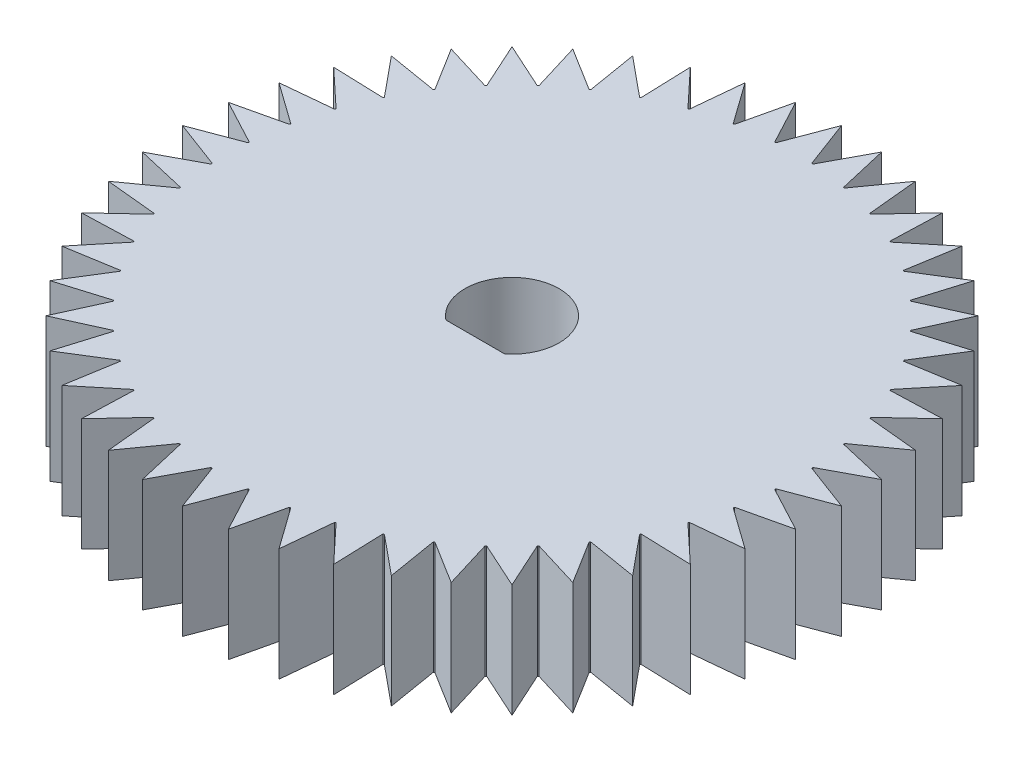
from build123d import *

# Parameters (mm, degrees)
EXTRUDE_5_DEPTH = 6


with BuildPart() as part:
    # Эскиз1 → Бобышка-Вытянуть5 (new body)
    with BuildSketch(Plane(origin=(0, 0, 0), x_dir=(1, 0, 0), z_dir=(0, 1, 0))):
        with BuildLine():
            Line((2.895366476, 14.71790926), (2.284208364, 17.350285074))
            Line((2.284208364, 17.350285074), (1.012565965, 14.965784649))
            ThreePointArc((1.012565965, 14.965784649), (0.981046938, 14.967883849), (0.949523561, 14.969916667))
            Line((0.949523561, 14.969916667), (0, 17.5))
            Line((0, 17.5), (-0.949523561, 14.969916667))
            ThreePointArc((-0.949523561, 14.969916667), (-0.981046938, 14.967883849), (-1.012565965, 14.965784649))
            Line((-1.012565965, 14.965784649), (-2.284208364, 17.350285074))
            Line((-2.284208364, 17.350285074), (-2.895366476, 14.71790926))
            ThreePointArc((-2.895366476, 14.71790926), (-2.92635483, 14.711779206), (-2.957330207, 14.705583907))
            Line((-2.957330207, 14.705583907), (-4.529333289, 16.90370196))
            Line((-4.529333289, 16.90370196), (-4.791668867, 14.214074344))
            ThreePointArc((-4.791668867, 14.214074344), (-4.82159198, 14.203951942), (-4.851493708, 14.193766547))
            Line((-4.851493708, 14.193766547), (-6.696960066, 16.167891819))
            Line((-6.696960066, 16.167891819), (-6.605984476, 13.467032676))
            ThreePointArc((-6.605984476, 13.467032676), (-6.634330353, 13.453091123), (-6.662646808, 13.439089906))
            Line((-6.662646808, 13.439089906), (-8.75, 15.155444566))
            Line((-8.75, 15.155444566), (-8.307269859, 12.489566345))
            ThreePointArc((-8.307269859, 12.489566345), (-8.333553495, 12.472044185), (-8.359800173, 12.454466711))
            Line((-8.359800173, 12.454466711), (-10.653325008, 13.883683455))
            Line((-10.653325008, 13.883683455), (-9.866415551, 11.298400071))
            ThreePointArc((-9.866415551, 11.298400071), (-9.890187227, 11.277597112), (-9.91391504, 11.256744138))
            Line((-9.91391504, 11.256744138), (-12.374368671, 12.374368671))
            Line((-12.374368671, 12.374368671), (-11.256744138, 9.91391504))
            ThreePointArc((-11.256744138, 9.91391504), (-11.277597112, 9.890187227), (-11.298400071, 9.866415551))
            Line((-11.298400071, 9.866415551), (-13.883683455, 10.653325008))
            Line((-13.883683455, 10.653325008), (-12.454466711, 8.359800173))
            ThreePointArc((-12.454466711, 8.359800173), (-12.472044185, 8.333553495), (-12.489566345, 8.307269859))
            Line((-12.489566345, 8.307269859), (-15.155444566, 8.75))
            Line((-15.155444566, 8.75), (-13.439089906, 6.662646808))
            ThreePointArc((-13.439089906, 6.662646808), (-13.453091123, 6.634330353), (-13.467032676, 6.605984476))
            Line((-13.467032676, 6.605984476), (-16.167891819, 6.696960066))
            Line((-16.167891819, 6.696960066), (-14.193766547, 4.851493708))
            ThreePointArc((-14.193766547, 4.851493708), (-14.203951942, 4.82159198), (-14.214074344, 4.791668867))
            Line((-14.214074344, 4.791668867), (-16.90370196, 4.529333289))
            Line((-16.90370196, 4.529333289), (-14.705583907, 2.957330207))
            ThreePointArc((-14.705583907, 2.957330207), (-14.711779206, 2.92635483), (-14.71790926, 2.895366476))
            Line((-14.71790926, 2.895366476), (-17.350285074, 2.284208364))
            Line((-17.350285074, 2.284208364), (-14.965784649, 1.012565965))
            ThreePointArc((-14.965784649, 1.012565965), (-14.967883849, 0.981046938), (-14.969916667, 0.949523561))
            Line((-14.969916667, 0.949523561), (-17.5, 0))
            Line((-17.5, 0), (-14.969916667, -0.949523561))
            ThreePointArc((-14.969916667, -0.949523561), (-14.967883849, -0.981046938), (-14.965784649, -1.012565965))
            Line((-14.965784649, -1.012565965), (-17.350285074, -2.284208364))
            Line((-17.350285074, -2.284208364), (-14.71790926, -2.895366476))
            ThreePointArc((-14.71790926, -2.895366476), (-14.711779206, -2.92635483), (-14.705583907, -2.957330207))
            Line((-14.705583907, -2.957330207), (-16.90370196, -4.529333289))
            Line((-16.90370196, -4.529333289), (-14.214074344, -4.791668867))
            ThreePointArc((-14.214074344, -4.791668867), (-14.203951942, -4.82159198), (-14.193766547, -4.851493708))
            Line((-14.193766547, -4.851493708), (-16.167891819, -6.696960066))
            Line((-16.167891819, -6.696960066), (-13.467032676, -6.605984476))
            ThreePointArc((-13.467032676, -6.605984476), (-13.453091123, -6.634330353), (-13.439089906, -6.662646808))
            Line((-13.439089906, -6.662646808), (-15.155444566, -8.75))
            Line((-15.155444566, -8.75), (-12.489566345, -8.307269859))
            ThreePointArc((-12.489566345, -8.307269859), (-12.472044185, -8.333553495), (-12.454466711, -8.359800173))
            Line((-12.454466711, -8.359800173), (-13.883683455, -10.653325008))
            Line((-13.883683455, -10.653325008), (-11.298400071, -9.866415551))
            ThreePointArc((-11.298400071, -9.866415551), (-11.277597112, -9.890187227), (-11.256744138, -9.91391504))
            Line((-11.256744138, -9.91391504), (-12.374368671, -12.374368671))
            Line((-12.374368671, -12.374368671), (-9.91391504, -11.256744138))
            ThreePointArc((-9.91391504, -11.256744138), (-9.890187227, -11.277597112), (-9.866415551, -11.298400071))
            Line((-9.866415551, -11.298400071), (-10.653325008, -13.883683455))
            Line((-10.653325008, -13.883683455), (-8.359800173, -12.454466711))
            ThreePointArc((-8.359800173, -12.454466711), (-8.333553495, -12.472044185), (-8.307269859, -12.489566345))
            Line((-8.307269859, -12.489566345), (-8.75, -15.155444566))
            Line((-8.75, -15.155444566), (-6.662646808, -13.439089906))
            ThreePointArc((-6.662646808, -13.439089906), (-6.634330353, -13.453091123), (-6.605984476, -13.467032676))
            Line((-6.605984476, -13.467032676), (-6.696960066, -16.167891819))
            Line((-6.696960066, -16.167891819), (-4.851493708, -14.193766547))
            ThreePointArc((-4.851493708, -14.193766547), (-4.82159198, -14.203951942), (-4.791668867, -14.214074344))
            Line((-4.791668867, -14.214074344), (-4.529333289, -16.90370196))
            Line((-4.529333289, -16.90370196), (-2.957330207, -14.705583907))
            ThreePointArc((-2.957330207, -14.705583907), (-2.92635483, -14.711779206), (-2.895366476, -14.71790926))
            Line((-2.895366476, -14.71790926), (-2.284208364, -17.350285074))
            Line((-2.284208364, -17.350285074), (-1.012565965, -14.965784649))
            ThreePointArc((-1.012565965, -14.965784649), (-0.981046938, -14.967883849), (-0.949523561, -14.969916667))
            Line((-0.949523561, -14.969916667), (0, -17.5))
            Line((0, -17.5), (0.949523561, -14.969916667))
            ThreePointArc((0.949523561, -14.969916667), (0.981046938, -14.967883849), (1.012565965, -14.965784649))
            Line((1.012565965, -14.965784649), (2.284208364, -17.350285074))
            Line((2.284208364, -17.350285074), (2.895366476, -14.71790926))
            ThreePointArc((2.895366476, -14.71790926), (2.92635483, -14.711779206), (2.957330207, -14.705583907))
            Line((2.957330207, -14.705583907), (4.529333289, -16.90370196))
            Line((4.529333289, -16.90370196), (4.791668867, -14.214074344))
            ThreePointArc((4.791668867, -14.214074344), (4.82159198, -14.203951942), (4.851493708, -14.193766547))
            Line((4.851493708, -14.193766547), (6.696960066, -16.167891819))
            Line((6.696960066, -16.167891819), (6.605984476, -13.467032676))
            ThreePointArc((6.605984476, -13.467032676), (6.634330353, -13.453091123), (6.662646808, -13.439089906))
            Line((6.662646808, -13.439089906), (8.75, -15.155444566))
            Line((8.75, -15.155444566), (8.307269859, -12.489566345))
            ThreePointArc((8.307269859, -12.489566345), (8.333553495, -12.472044185), (8.359800173, -12.454466711))
            Line((8.359800173, -12.454466711), (10.653325008, -13.883683455))
            Line((10.653325008, -13.883683455), (9.866415551, -11.298400071))
            ThreePointArc((9.866415551, -11.298400071), (9.890187227, -11.277597112), (9.91391504, -11.256744138))
            Line((9.91391504, -11.256744138), (12.374368671, -12.374368671))
            Line((12.374368671, -12.374368671), (11.256744138, -9.91391504))
            ThreePointArc((11.256744138, -9.91391504), (11.277597112, -9.890187227), (11.298400071, -9.866415551))
            Line((11.298400071, -9.866415551), (13.883683455, -10.653325008))
            Line((13.883683455, -10.653325008), (12.454466711, -8.359800173))
            ThreePointArc((12.454466711, -8.359800173), (12.472044185, -8.333553495), (12.489566345, -8.307269859))
            Line((12.489566345, -8.307269859), (15.155444566, -8.75))
            Line((15.155444566, -8.75), (13.439089906, -6.662646808))
            ThreePointArc((13.439089906, -6.662646808), (13.453091123, -6.634330353), (13.467032676, -6.605984476))
            Line((13.467032676, -6.605984476), (16.167891819, -6.696960066))
            Line((16.167891819, -6.696960066), (14.193766547, -4.851493708))
            ThreePointArc((14.193766547, -4.851493708), (14.203951942, -4.82159198), (14.214074344, -4.791668867))
            Line((14.214074344, -4.791668867), (16.90370196, -4.529333289))
            Line((16.90370196, -4.529333289), (14.705583907, -2.957330207))
            ThreePointArc((14.705583907, -2.957330207), (14.711779206, -2.92635483), (14.71790926, -2.895366476))
            Line((14.71790926, -2.895366476), (17.350285074, -2.284208364))
            Line((17.350285074, -2.284208364), (14.965784649, -1.012565965))
            ThreePointArc((14.965784649, -1.012565965), (14.967883849, -0.981046938), (14.969916667, -0.949523561))
            Line((14.969916667, -0.949523561), (17.5, 0))
            Line((17.5, 0), (14.969916667, 0.949523561))
            ThreePointArc((14.969916667, 0.949523561), (14.967883849, 0.981046938), (14.965784649, 1.012565965))
            Line((14.965784649, 1.012565965), (17.350285074, 2.284208364))
            Line((17.350285074, 2.284208364), (14.71790926, 2.895366476))
            ThreePointArc((14.71790926, 2.895366476), (14.711779206, 2.92635483), (14.705583907, 2.957330207))
            Line((14.705583907, 2.957330207), (16.90370196, 4.529333289))
            Line((16.90370196, 4.529333289), (14.214074344, 4.791668867))
            ThreePointArc((14.214074344, 4.791668867), (14.203951942, 4.82159198), (14.193766547, 4.851493708))
            Line((14.193766547, 4.851493708), (16.167891819, 6.696960066))
            Line((16.167891819, 6.696960066), (13.467032676, 6.605984476))
            ThreePointArc((13.467032676, 6.605984476), (13.453091123, 6.634330353), (13.439089906, 6.662646808))
            Line((13.439089906, 6.662646808), (15.155444566, 8.75))
            Line((15.155444566, 8.75), (12.489566345, 8.307269859))
            ThreePointArc((12.489566345, 8.307269859), (12.472044185, 8.333553495), (12.454466711, 8.359800173))
            Line((12.454466711, 8.359800173), (13.883683455, 10.653325008))
            Line((13.883683455, 10.653325008), (11.298400071, 9.866415551))
            ThreePointArc((11.298400071, 9.866415551), (11.277597112, 9.890187227), (11.256744138, 9.91391504))
            Line((11.256744138, 9.91391504), (12.374368671, 12.374368671))
            Line((12.374368671, 12.374368671), (9.91391504, 11.256744138))
            ThreePointArc((9.91391504, 11.256744138), (9.890187227, 11.277597112), (9.866415551, 11.298400071))
            Line((9.866415551, 11.298400071), (10.653325008, 13.883683455))
            Line((10.653325008, 13.883683455), (8.359800173, 12.454466711))
            ThreePointArc((8.359800173, 12.454466711), (8.333553495, 12.472044185), (8.307269859, 12.489566345))
            Line((8.307269859, 12.489566345), (8.75, 15.155444566))
            Line((8.75, 15.155444566), (6.662646808, 13.439089906))
            ThreePointArc((6.662646808, 13.439089906), (6.634330353, 13.453091123), (6.605984476, 13.467032676))
            Line((6.605984476, 13.467032676), (6.696960066, 16.167891819))
            Line((6.696960066, 16.167891819), (4.851493708, 14.193766547))
            ThreePointArc((4.851493708, 14.193766547), (4.82159198, 14.203951942), (4.791668867, 14.214074344))
            Line((4.791668867, 14.214074344), (4.529333289, 16.90370196))
            Line((4.529333289, 16.90370196), (2.957330207, 14.705583907))
            ThreePointArc((2.957330207, 14.705583907), (2.92635483, 14.711779206), (2.895366476, 14.71790926))
        make_face()
        with BuildLine():
            ThreePointArc((-1.564448785, -1.95), (0, 2.5), (1.564448785, -1.95))
            Line((1.564448785, -1.95), (-1.564448785, -1.95))
        make_face(mode=Mode.SUBTRACT)
    extrude(amount=EXTRUDE_5_DEPTH)


solid = part.part
